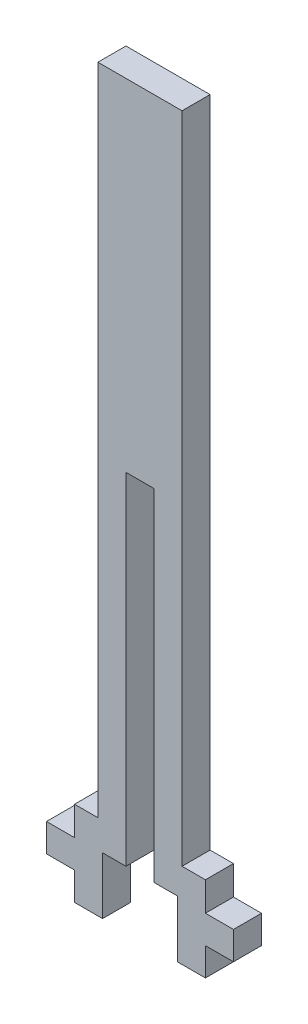
from build123d import *

# Parameters (mm, degrees)
EXTRUDE_1_DEPTH     = 3
SKETCH_2_W          = 3
SKETCH_2_H          = 36.493999941
CUT_EXTRUDE_1_DEPTH = 3
SKETCH_3_W          = 3
SKETCH_3_H          = 3
EXTRUDE_2_DEPTH     = 3


with BuildPart() as part:
    # 스케치1 → 보스-돌출1 (new body)
    with BuildSketch(Plane.XY):
        Polygon((-4.5, 39.543999941), (4.5, 39.543999941), (4.5, -30.443999941), (7, -30.443999941), (7, -39.543999941), (4, -39.543999941), (4, -33.443999941), (-4, -33.443999941), (-4, -39.543999941), (-7, -39.543999941), (-7, -30.443999941), (-4.5, -30.443999941), align=None)
    extrude(amount=EXTRUDE_1_DEPTH)

    # 스케치2 → 컷-돌출1 (cut)
    with BuildSketch(Plane(origin=(0, 0, 0), x_dir=(-1, 0, 0), z_dir=(0, 0, -1))):
        with Locations((0, -15.196999971)):
            Rectangle(SKETCH_2_W, SKETCH_2_H)
    extrude(amount=-CUT_EXTRUDE_1_DEPTH, mode=Mode.SUBTRACT)

    # 스케치3 → 보스-돌출2 (add)
    with BuildSketch(Plane.XY.offset(3)):
        with Locations((-8.5, -35.043999941)):
            Rectangle(SKETCH_3_W, SKETCH_3_H)
        with Locations((8.5, -35.043999941)):
            Rectangle(SKETCH_3_W, SKETCH_3_H)
    extrude(amount=-EXTRUDE_2_DEPTH)


solid = part.part
